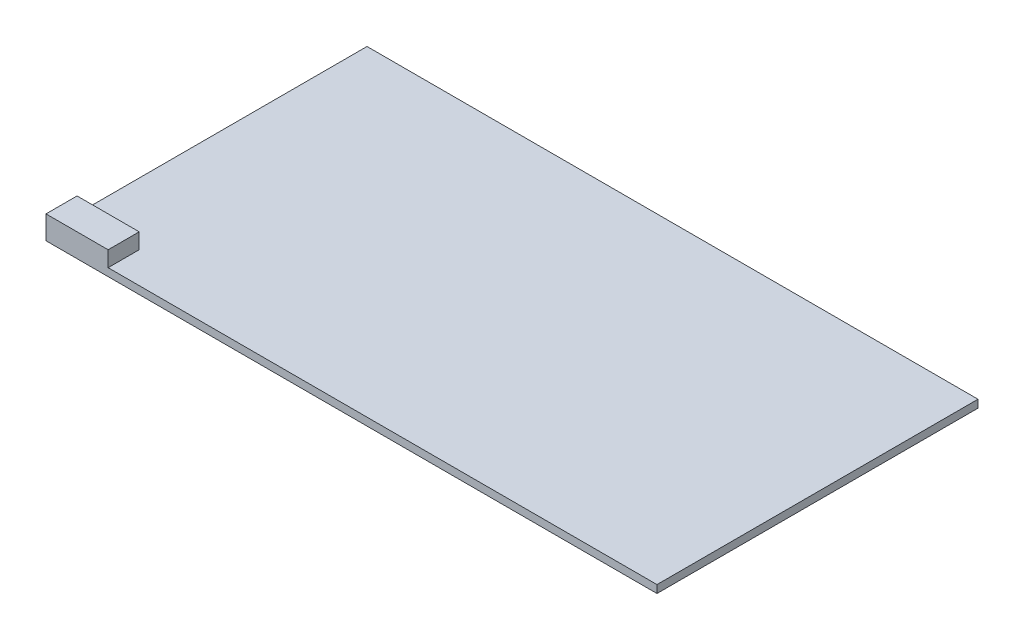
from build123d import *

# Parameters (mm, degrees)
CROQUIS1_W              = 118
CROQUIS1_H              = 62
SALIENTE_EXTRUIR1_DEPTH = 1.5
SKETCH_4_W              = 12
SKETCH_4_H              = 6
EXTRUDE_2_DEPTH         = 3


with BuildPart() as part:
    # Croquis1 → Saliente-Extruir1 (new body)
    with BuildSketch(Plane(origin=(0, 0, 0), x_dir=(1, 0, 0), z_dir=(0, 1, 0))):
        with Locations((59, 31)):
            Rectangle(CROQUIS1_W, CROQUIS1_H)
    extrude(amount=SALIENTE_EXTRUIR1_DEPTH)

    # 草图4 → 凸台-拉伸2 (add)
    with BuildSketch(Plane(origin=(0, 1.5, 0), x_dir=(1, 0, 0), z_dir=(0, 1, 0))):
        with Locations((6, 3)):
            Rectangle(SKETCH_4_W, SKETCH_4_H)
    extrude(amount=EXTRUDE_2_DEPTH)


solid = part.part
